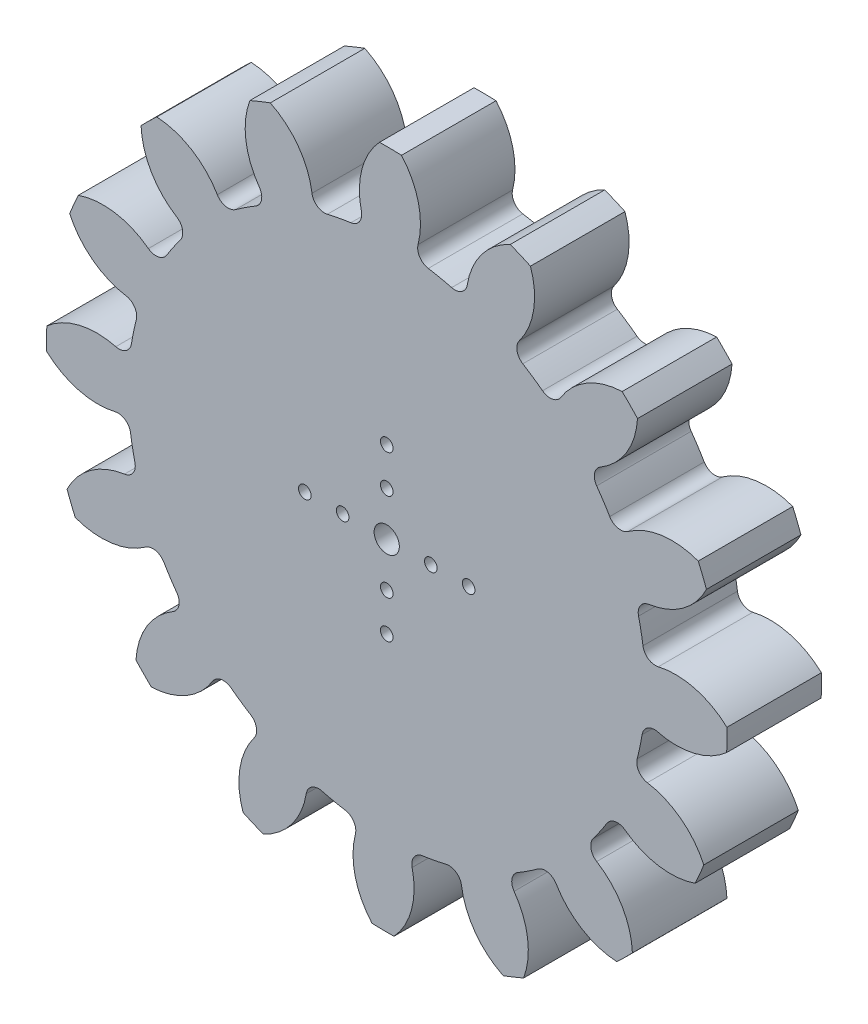
from build123d import *

# Parameters (mm, degrees)
SKETCH12_R               = 41.058
BOSS_EXTRUDE2_DEPTH      = 7.5
BOSS_EXTRUDE3_DEPTH      = 7.5
FILLET1_R                = 2
CIRPATTERN2_COUNT        = 16
FILLET1_OF_CIRPATTERN2_R = 2
CROQUIS1_R               = 1
CORTAR_EXTRUIR1_DEPTH    = 15
CROQUIS2_R               = 2
CORTAR_EXTRUIR2_DEPTH    = 15
SKETCH14_R               = 1
CUT_EXTRUDE1_DEPTH       = 15


with BuildPart() as part:
    # Sketch12 → Boss-Extrude2 (new, symmetric)
    with BuildSketch(Plane.XY):
        Circle(SKETCH12_R)
    extrude(amount=BOSS_EXTRUDE2_DEPTH, both=True)

    # Sketch13 → Boss-Extrude3 (add, symmetric)
    with BuildSketch(Plane.XY):
        with BuildLine():
            ThreePointArc((-36.131038031, 19.501473145), (-37.757393461, 16.128812822), (-39.069733886, 12.622014818))
            ThreePointArc((-39.069733886, 12.622014818), (-45.74280782, 14.417177539), (-50.319452764, 19.594710347))
            ThreePointArc((-50.319452764, 19.594710347), (-49.659000606, 21.212818267), (-48.946531321, 22.808706049))
            ThreePointArc((-48.946531321, 22.808706049), (-42.041604001, 23.081659568), (-36.131038031, 19.501473145))
        make_face()
    boss_extrude3 = extrude(amount=BOSS_EXTRUDE3_DEPTH, both=True)

    # Fillet1
    fillet1_edges = [part.edges().sort_by_distance(p)[0] for p in [
        (-36.131038031, 19.501473145, 0),
        (-39.069733886, 12.622014818, 0),
    ]]
    fillet(fillet1_edges, radius=FILLET1_R)

    # CirPattern2: Boss-Extrude3 ×16 about axis
    cirpattern2_axis = Axis((0, 0, 0), (0, 0, 1))
    for i in range(1, CIRPATTERN2_COUNT):
        add(boss_extrude3.rotate(cirpattern2_axis, i * 360 / CIRPATTERN2_COUNT))

    # Fillet1 of CirPattern2
    fillet1_of_cirpattern2_edges = [part.edges().sort_by_distance(p)[0] for p in [
        (-40.843617204, 4.190262243, 0),
        (-40.925963432, -3.290118716, 0),
        (-39.338125907, -11.758878099, 0),
        (-36.55158604, -18.7013615, 0),
        (-31.843761541, -25.917835846, 0),
        (-26.612561015, -31.265491524, 0),
        (-19.501473145, -36.131038031, 0),
        (-12.622014818, -39.069733886, 0),
        (-4.190262243, -40.843617204, 0),
        (3.290118716, -40.925963432, 0),
        (11.758878099, -39.338125907, 0),
        (18.7013615, -36.55158604, 0),
        (25.917835846, -31.843761541, 0),
        (31.265491524, -26.612561015, 0),
        (36.131038031, -19.501473145, 0),
        (39.069733886, -12.622014818, 0),
        (40.843617204, -4.190262243, 0),
        (40.925963432, 3.290118716, 0),
        (39.338125907, 11.758878099, 0),
        (36.55158604, 18.7013615, 0),
        (31.843761541, 25.917835846, 0),
        (26.612561015, 31.265491524, 0),
        (19.501473145, 36.131038031, 0),
        (12.622014818, 39.069733886, 0),
        (4.190262243, 40.843617204, 0),
        (-3.290118716, 40.925963432, 0),
        (-11.758878099, 39.338125907, 0),
        (-18.7013615, 36.55158604, 0),
        (-25.917835846, 31.843761541, 0),
        (-31.265491524, 26.612561015, 0),
    ]]
    fillet(fillet1_of_cirpattern2_edges, radius=FILLET1_OF_CIRPATTERN2_R)

    # Croquis1 → Cortar-Extruir1 (cut)
    with BuildSketch(Plane(origin=(0, 0, -7.5), x_dir=(-1, 0, 0), z_dir=(0, 0, -1))):
        with Locations((7, 0)):
            Circle(CROQUIS1_R)
        with Locations((13, 0)):
            Circle(CROQUIS1_R)
        with Locations((-7, 0)):
            Circle(CROQUIS1_R)
        with Locations((-13, 0)):
            Circle(CROQUIS1_R)
    extrude(amount=-CORTAR_EXTRUIR1_DEPTH, mode=Mode.SUBTRACT)

    # Croquis2 → Cortar-Extruir2 (cut)
    with BuildSketch(Plane(origin=(0, 0, -7.5), x_dir=(-1, 0, 0), z_dir=(0, 0, -1))):
        Circle(CROQUIS2_R)
    extrude(amount=-CORTAR_EXTRUIR2_DEPTH, mode=Mode.SUBTRACT)

    # Sketch14 → Cut-Extrude1 (cut)
    with BuildSketch(Plane(origin=(0, 0, -7.5), x_dir=(-1, 0, 0), z_dir=(0, 0, -1))):
        with Locations((0, 7)):
            Circle(SKETCH14_R)
        with Locations((0, 13)):
            Circle(SKETCH14_R)
        with Locations((0, -7)):
            Circle(SKETCH14_R)
        with Locations((0, -13)):
            Circle(SKETCH14_R)
    extrude(amount=-CUT_EXTRUDE1_DEPTH, mode=Mode.SUBTRACT)


solid = part.part
